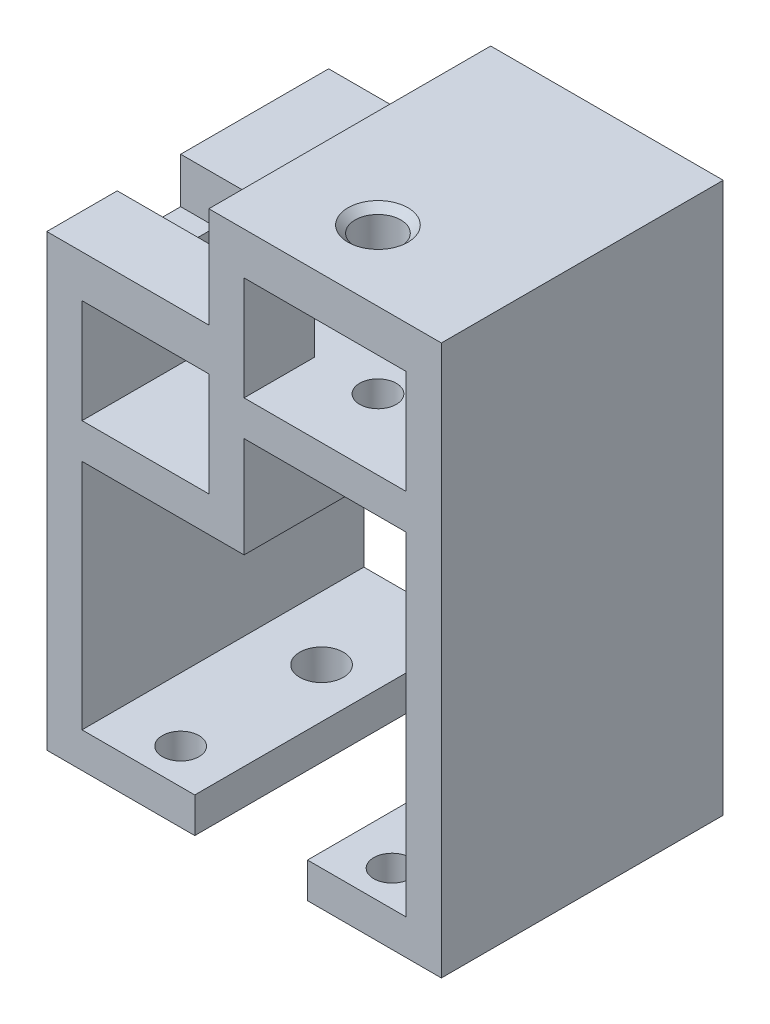
from build123d import *

# Parameters (mm, degrees)
SKETCH1_W           = 23
SKETCH1_H           = 14.75
SKETCH1_W_2         = 18
BOSS_EXTRUDE1_DEPTH = 40
CUT_EXTRUDE1_REACH  = 106.057
SKETCH2_R           = 2.6
CUT_EXTRUDE2_REACH  = 94.064
SKETCH3_W           = 9
SKETCH3_H           = 14.75
SKETCH4_W           = 10
SKETCH4_H           = 14.75
CUT_EXTRUDE3_DEPTH  = 102.453449917
CUT_EXTRUDE4_REACH  = 106.057
SKETCH6_R           = 3.25
CHAMFER1_SIZE       = 1
CUT_EXTRUDE5_REACH  = 106.057
SKETCH7_R           = 2.6
SKETCH7_R_2         = 3.1


with BuildPart() as part:
    # Sketch1 → Boss-Extrude1 (new body)
    with BuildSketch(Plane.XY):
        Polygon((0, 0), (0, 63.75), (23, 63.75), (23, 78.05), (56, 78.05), (56, 0), (37, 0), (37, 5), (51, 5), (51, 52.3), (28, 52.3), (28, 38), (5, 38), (5, 5), (21, 5), (21, 0), align=None)
        with Locations((39.5, 64.675)):
            Rectangle(SKETCH1_W, SKETCH1_H, mode=Mode.SUBTRACT)
        with Locations((14, 50.375)):
            Rectangle(SKETCH1_W_2, SKETCH1_H, mode=Mode.SUBTRACT)
    extrude(amount=BOSS_EXTRUDE1_DEPTH)

    # Cut-Extrude1: up to this face of the body (flat: up to its plane)
    cut_extrude1_end = Plane(part.part.faces().sort_by_distance((16.5, 38, 20))[0])
    # Sketch2 → Cut-Extrude1 (cut, up to the picked face)
    with BuildSketch(Plane(origin=(0, 78.05, 0), x_dir=(1, 0, 0), z_dir=(0, 1, 0)), mode=Mode.PRIVATE) as cut_extrude1_sk1:
        with Locations(Location((14, -15, 0), (0, 0, 270))):
            Circle(SKETCH2_R)
    cut_extrude1_tool1 = split(extrude(cut_extrude1_sk1.sketch, amount=-CUT_EXTRUDE1_REACH, mode=Mode.PRIVATE), bisect_by=cut_extrude1_end, keep=Keep.BOTH, mode=Mode.PRIVATE)
    # Sketch2 → Cut-Extrude1 (cut, up to the picked face)
    with BuildSketch(Plane(origin=(0, 78.05, 0), x_dir=(1, 0, 0), z_dir=(0, 1, 0)), mode=Mode.PRIVATE) as cut_extrude1_sk2:
        with Locations((37, -30)):
            Circle(SKETCH2_R)
    cut_extrude1_tool2 = split(extrude(cut_extrude1_sk2.sketch, amount=-CUT_EXTRUDE1_REACH, mode=Mode.PRIVATE), bisect_by=cut_extrude1_end, keep=Keep.BOTH, mode=Mode.PRIVATE)
    add(cut_extrude1_tool1.solids().sort_by(Axis((14, 78.05, 15), (0, -1, 0)))[0], mode=Mode.SUBTRACT)
    add(cut_extrude1_tool2.solids().sort_by(Axis((37, 78.05, 30), (0, -1, 0)))[0], mode=Mode.SUBTRACT)

    # Sketch3 → Cut-Extrude2 (cut, up to next)
    with BuildSketch(Plane(origin=(28, 0, 0), x_dir=(0, 0, -1), z_dir=(1, 0, 0)), mode=Mode.PRIVATE) as cut_extrude2_sk1:
        with Locations((-25.5, 64.675)):
            Rectangle(SKETCH3_W, SKETCH3_H)
    cut_extrude2_tool1 = extrude(cut_extrude2_sk1.sketch, amount=-CUT_EXTRUDE2_REACH, mode=Mode.PRIVATE) & part.part
    add(cut_extrude2_tool1.solids().sort_by_distance((28, 64.675, 25.5))[0], mode=Mode.SUBTRACT)

    # Sketch4 → Cut-Extrude3 (cut, through all)
    with BuildSketch(Plane(origin=(5, 0, 0), x_dir=(0, 0, -1), z_dir=(1, 0, 0))):
        with Locations((-10, 50.375)):
            Rectangle(SKETCH4_W, SKETCH4_H)
    extrude(amount=-CUT_EXTRUDE3_DEPTH, mode=Mode.SUBTRACT)

    # Sketch6 → Cut-Extrude4 (cut, up to next)
    with BuildSketch(Plane(origin=(0, 78.05, 0), x_dir=(1, 0, 0), z_dir=(0, 1, 0)), mode=Mode.PRIVATE) as cut_extrude4_sk1:
        with Locations(Location((14, -15, 0), (0, 0, 270))):
            Circle(SKETCH6_R)
    cut_extrude4_tool1 = extrude(cut_extrude4_sk1.sketch, amount=-CUT_EXTRUDE4_REACH, mode=Mode.PRIVATE) & part.part
    # Sketch6 → Cut-Extrude4 (cut, up to next)
    with BuildSketch(Plane(origin=(0, 78.05, 0), x_dir=(1, 0, 0), z_dir=(0, 1, 0)), mode=Mode.PRIVATE) as cut_extrude4_sk2:
        with Locations(Location((37, -30, 0), (0, 0, 270))):
            Circle(SKETCH6_R)
    cut_extrude4_tool2 = extrude(cut_extrude4_sk2.sketch, amount=-CUT_EXTRUDE4_REACH, mode=Mode.PRIVATE) & part.part
    add(cut_extrude4_tool1.solids().sort_by_distance((14, 78.05, 15))[0], mode=Mode.SUBTRACT)
    add(cut_extrude4_tool2.solids().sort_by_distance((37, 78.05, 30))[0], mode=Mode.SUBTRACT)

    # Chamfer1
    chamfer1_edges = [part.edges().sort_by_distance(p)[0] for p in [
        (14, 63.75, 11.75),
        (37, 78.05, 26.75),
    ]]
    chamfer(chamfer1_edges, length=CHAMFER1_SIZE)

    # Sketch7 → Cut-Extrude5 (cut, up to next)
    with BuildSketch(Plane.XZ, mode=Mode.PRIVATE) as cut_extrude5_sk1:
        with Locations((14, 35)):
            Circle(SKETCH7_R)
    cut_extrude5_tool1 = extrude(cut_extrude5_sk1.sketch, amount=-CUT_EXTRUDE5_REACH, mode=Mode.PRIVATE) & part.part
    # Sketch7 → Cut-Extrude5 (cut, up to next)
    with BuildSketch(Plane.XZ, mode=Mode.PRIVATE) as cut_extrude5_sk2:
        with Locations((44, 35)):
            Circle(SKETCH7_R)
    cut_extrude5_tool2 = extrude(cut_extrude5_sk2.sketch, amount=-CUT_EXTRUDE5_REACH, mode=Mode.PRIVATE) & part.part
    # Sketch7 → Cut-Extrude5 (cut, up to next)
    with BuildSketch(Plane.XZ, mode=Mode.PRIVATE) as cut_extrude5_sk3:
        with Locations((14, 15)):
            Circle(SKETCH7_R_2)
    cut_extrude5_tool3 = extrude(cut_extrude5_sk3.sketch, amount=-CUT_EXTRUDE5_REACH, mode=Mode.PRIVATE) & part.part
    # Sketch7 → Cut-Extrude5 (cut, up to next)
    with BuildSketch(Plane.XZ, mode=Mode.PRIVATE) as cut_extrude5_sk4:
        with Locations((44, 15)):
            Circle(SKETCH7_R_2)
    cut_extrude5_tool4 = extrude(cut_extrude5_sk4.sketch, amount=-CUT_EXTRUDE5_REACH, mode=Mode.PRIVATE) & part.part
    add(cut_extrude5_tool1.solids().sort_by_distance((14, 0, 35))[0], mode=Mode.SUBTRACT)
    add(cut_extrude5_tool2.solids().sort_by_distance((44, 0, 35))[0], mode=Mode.SUBTRACT)
    add(cut_extrude5_tool3.solids().sort_by_distance((14, 0, 15))[0], mode=Mode.SUBTRACT)
    add(cut_extrude5_tool4.solids().sort_by_distance((44, 0, 15))[0], mode=Mode.SUBTRACT)


solid = part.part
